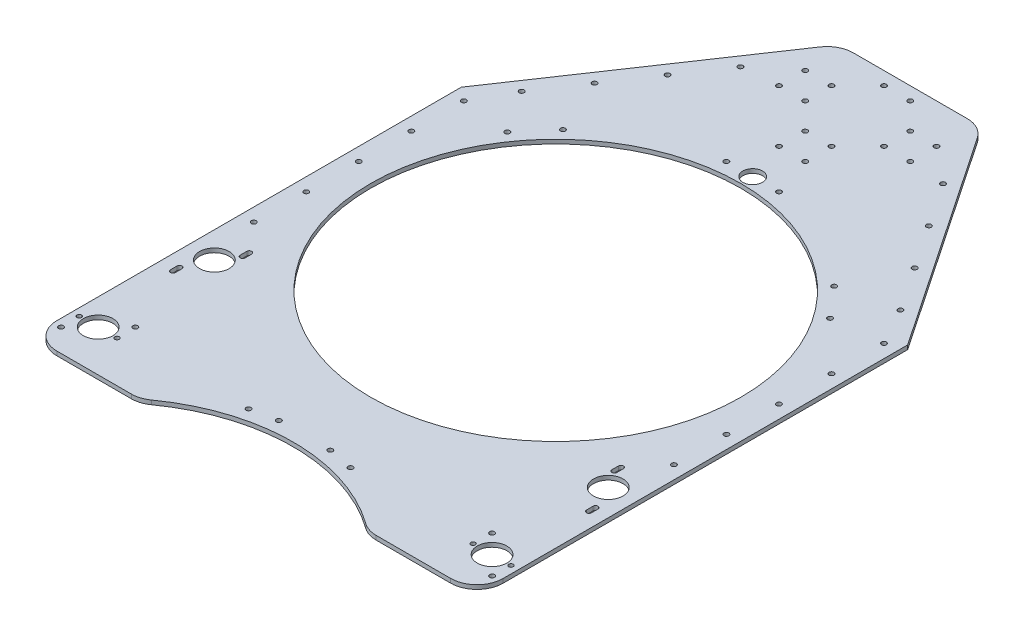
from build123d import *

# Parameters (mm, degrees)
SKETCH1_W           = 431.8
SKETCH1_H           = 685.8
BOSS_EXTRUDE1_DEPTH = 4
SKETCH2_R           = 14.3129
SKETCH2_R_2         = 2.38125
SKETCH2_R_3         = 2.159
CUT_EXTRUDE1_DEPTH  = 406.227368276
SKETCH6_R           = 179.07
CUT_EXTRUDE4_DEPTH  = 406.227368276
SKETCH8_R           = 9.525
SKETCH8_R_2         = 2.38125
CUT_EXTRUDE6_DEPTH  = 406.227368276
FILLET2_R           = 25.4
SKETCH11_R          = 2.38125
CUT_EXTRUDE9_DEPTH  = 406.227368276
SKETCH13_R          = 2.38125
SKETCH13_R_2        = 2.466421692
SKETCH13_R_3        = 2.307769972
CUT_EXTRUDE10_DEPTH = 406.227368276
SKETCH16_W          = 431.8
SKETCH16_H          = 50.8
CUT_EXTRUDE13_DEPTH = 406.227368276
SKETCH17_R          = 177.8
SKETCH17_R_2        = 2.38125
CUT_EXTRUDE14_DEPTH = 406.227368276
FILLET3_R           = 25.4
SKETCH18_R          = 2.38125
CUT_EXTRUDE15_DEPTH = 406.227368276
CHAMFER1_SIZE       = 147.32
CHAMFER1_SIZE2      = 218.410881881
CHAMFER2_SIZE       = 147.32
CHAMFER2_SIZE2      = 218.410881881
FILLET4_R           = 25.4
SKETCH19_R          = 2.38125
CUT_EXTRUDE16_DEPTH = 406.227368276


with BuildPart() as part:
    # Sketch1 → Boss-Extrude1 (new body)
    with BuildSketch(Plane(origin=(0, 0, 0), x_dir=(1, 0, 0), z_dir=(0, 1, 0))):
        Rectangle(SKETCH1_W, SKETCH1_H)
    extrude(amount=BOSS_EXTRUDE1_DEPTH)

    # Sketch2 → Cut-Extrude1 (cut, through all)
    with BuildSketch(Plane(origin=(0, 4, 0), x_dir=(1, 0, 0), z_dir=(0, 1, 0))):
        with Locations(Location((190.5, -302.895, 0), (0, 0, 270))):
            Circle(SKETCH2_R)
        with Locations(Location((208.460512242, -320.855512242, 0), (0, 0, 270))):
            Circle(SKETCH2_R_2)
        with Locations(Location((208.788, -302.895, 0), (0, 0, 270))):
            Circle(SKETCH2_R_3)
        with Locations(Location((172.212, -302.895, 0), (0, 0, 270))):
            Circle(SKETCH2_R_3)
        with Locations(Location((172.539487758, -284.934487758, 0), (0, 0, 270))):
            Circle(SKETCH2_R_2)
        with Locations((201.234503848, -219.870217791)):
            Circle(SKETCH2_R_2)
        with BuildLine():
            ThreePointArc((198.853253848, -219.870217791), (201.234503848, -217.488967791), (203.615753848, -219.870217791))
            Line((203.615753848, -219.870217791), (203.615753848, -213.520217791))
            ThreePointArc((203.615753848, -213.520217791), (201.234503848, -215.901467791), (198.853253848, -213.520217791))
            Line((198.853253848, -213.520217791), (198.853253848, -219.870217791))
        make_face()
        with Locations((201.234503848, -213.520217791)):
            Circle(SKETCH2_R_2)
        with Locations(Location((190.5, -190.5, 0), (0, 0, 270))):
            Circle(SKETCH2_R)
        with Locations((179.765496152, -173.829782209)):
            Circle(SKETCH2_R_2)
        with BuildLine():
            ThreePointArc((177.384246152, -173.829782209), (179.765496152, -171.448532209), (182.146746152, -173.829782209))
            Line((182.146746152, -173.829782209), (182.146746152, -167.479782209))
            ThreePointArc((182.146746152, -167.479782209), (179.765496152, -169.861032209), (177.384246152, -167.479782209))
            Line((177.384246152, -167.479782209), (177.384246152, -173.829782209))
        make_face()
        with Locations((179.765496152, -167.479782209)):
            Circle(SKETCH2_R_2)
        with Locations((-179.765496152, -167.479782209)):
            Circle(SKETCH2_R_2)
        with Locations((-179.765496152, -173.829782209)):
            Circle(SKETCH2_R_2)
        with BuildLine():
            ThreePointArc((-182.146746152, -173.829782209), (-179.765496152, -171.448532209), (-177.384246152, -173.829782209))
            Line((-177.384246152, -173.829782209), (-177.384246152, -167.479782209))
            ThreePointArc((-177.384246152, -167.479782209), (-179.765496152, -169.861032209), (-182.146746152, -167.479782209))
            Line((-182.146746152, -167.479782209), (-182.146746152, -173.829782209))
        make_face()
        with Locations(Location((-190.5, -190.5, 0), (0, 0, 270))):
            Circle(SKETCH2_R)
        with Locations((-201.234503848, -213.520217791)):
            Circle(SKETCH2_R_2)
        with Locations((-201.234503848, -219.870217791)):
            Circle(SKETCH2_R_2)
        with Locations(Location((-190.5, -302.895, 0), (0, 0, 270))):
            Circle(SKETCH2_R)
        with Locations(Location((-208.460512242, -320.855512242, 0), (0, 0, 270))):
            Circle(SKETCH2_R_2)
        with Locations(Location((-208.788, -302.895, 0), (0, 0, 270))):
            Circle(SKETCH2_R_3)
        with Locations(Location((-172.212, -302.895, 0), (0, 0, 270))):
            Circle(SKETCH2_R_3)
        with Locations(Location((-172.539487758, -284.934487758, 0), (0, 0, 270))):
            Circle(SKETCH2_R_2)
        with BuildLine():
            ThreePointArc((-203.615753848, -219.870217791), (-201.234503848, -217.488967791), (-198.853253848, -219.870217791))
            Line((-198.853253848, -219.870217791), (-198.853253848, -213.520217791))
            ThreePointArc((-198.853253848, -213.520217791), (-201.234503848, -215.901467791), (-203.615753848, -213.520217791))
            Line((-203.615753848, -213.520217791), (-203.615753848, -219.870217791))
        make_face()
    extrude(amount=-CUT_EXTRUDE1_DEPTH, mode=Mode.SUBTRACT)

    # Sketch6 → Cut-Extrude4 (cut, through all)
    with BuildSketch(Plane(origin=(0, 4, 0), x_dir=(1, 0, 0), z_dir=(0, 1, 0))):
        with Locations(Location((0, -50.8, 0), (0, 0, 270))):
            Circle(SKETCH6_R)
    extrude(amount=-CUT_EXTRUDE4_DEPTH, mode=Mode.SUBTRACT)

    # Sketch8 → Cut-Extrude6 (cut, through all)
    with BuildSketch(Plane(origin=(0, 4, 0), x_dir=(1, 0, 0), z_dir=(0, 1, 0))):
        with Locations(Location((0, 139.7, 0), (0, 0, 270))):
            Circle(SKETCH8_R)
        with Locations(Location((25.4, 139.7, 0), (0, 0, 270))):
            Circle(SKETCH8_R_2)
        with Locations(Location((-25.4, 139.7, 0), (0, 0, 270))):
            Circle(SKETCH8_R_2)
    extrude(amount=-CUT_EXTRUDE6_DEPTH, mode=Mode.SUBTRACT)

    # Fillet2
    fillet2_edges = [part.edges().sort_by_distance(p)[0] for p in [
        (215.9, 2, 342.9),
        (-215.9, 2, 342.9),
    ]]
    fillet(fillet2_edges, radius=FILLET2_R)

    # Sketch11 → Cut-Extrude9 (cut, through all)
    with BuildSketch(Plane(origin=(0, 4, 0), x_dir=(1, 0, 0), z_dir=(0, 1, 0))):
        with Locations(Location((156.048464437, 58.466311125, 0), (0, 0, 270))):
            Circle(SKETCH11_R)
        with Locations(Location((131.183773775, 87.334237241, 0), (0, 0, 270))):
            Circle(SKETCH11_R)
        with Locations(Location((-131.183773775, 87.334237241, 0), (0, 0, 270))):
            Circle(SKETCH11_R)
        with Locations(Location((-156.048464437, 58.466311125, 0), (0, 0, 270))):
            Circle(SKETCH11_R)
    extrude(amount=-CUT_EXTRUDE9_DEPTH, mode=Mode.SUBTRACT)

    # Sketch13 → Cut-Extrude10 (cut, through all)
    with BuildSketch(Plane(origin=(0, 4, 0), x_dir=(1, 0, 0), z_dir=(0, 1, 0))):
        with Locations(Location((-203.2, 317.5, 0), (0, 0, 270))):
            Circle(SKETCH13_R)
        with Locations(Location((-203.2, 266.7, 0), (0, 0, 270))):
            Circle(SKETCH13_R)
        with Locations(Location((-203.2, 215.9, 0), (0, 0, 270))):
            Circle(SKETCH13_R)
        with Locations(Location((-203.2, 165.1, 0), (0, 0, 270))):
            Circle(SKETCH13_R)
        with Locations(Location((-203.2, 114.3, 0), (0, 0, 270))):
            Circle(SKETCH13_R)
        with Locations(Location((-203.2, 63.5, 0), (0, 0, 270))):
            Circle(SKETCH13_R)
        with Locations(Location((-203.2, 12.7, 0), (0, 0, 270))):
            Circle(SKETCH13_R)
        with Locations(Location((-203.2, -38.1, 0), (0, 0, 270))):
            Circle(SKETCH13_R)
        with Locations(Location((-203.2, -88.9, 0), (0, 0, 270))):
            Circle(SKETCH13_R)
        with Locations(Location((-203.2, -139.7, 0), (0, 0, 270))):
            Circle(SKETCH13_R)
        with Locations(Location((203.2, -139.7, 0), (0, 0, 90))):
            Circle(SKETCH13_R)
        with Locations(Location((203.2, 12.7, 0), (0, 0, 90))):
            Circle(SKETCH13_R)
        with Locations(Location((203.2, 63.5, 0), (0, 0, 90))):
            Circle(SKETCH13_R)
        with Locations(Location((203.2, 114.3, 0), (0, 0, 90))):
            Circle(SKETCH13_R)
        with Locations(Location((203.2, 165.1, 0), (0, 0, 90))):
            Circle(SKETCH13_R)
        with Locations(Location((203.2, 266.7, 0), (0, 0, 90))):
            Circle(SKETCH13_R)
        with Locations(Location((203.2, 317.5, 0), (0, 0, 90))):
            Circle(SKETCH13_R)
        with Locations(Location((-25.4, -330.2, 0), (0, 0, 270))):
            Circle(SKETCH13_R_2)
        with Locations(Location((-50.8, -330.2, 0), (0, 0, 270))):
            Circle(SKETCH13_R_3)
        with Locations(Location((50.8, -330.2, 0), (0, 0, 90))):
            Circle(SKETCH13_R_3)
        with Locations(Location((25.4, -330.2, 0), (0, 0, 90))):
            Circle(SKETCH13_R_2)
        with Locations(Location((203.2, -88.9, 0), (0, 0, 90))):
            Circle(SKETCH13_R)
        with Locations(Location((203.2, -38.1, 0), (0, 0, 90))):
            Circle(SKETCH13_R)
        with Locations(Location((203.2, 215.9, 0), (0, 0, 90))):
            Circle(SKETCH13_R)
    extrude(amount=-CUT_EXTRUDE10_DEPTH, mode=Mode.SUBTRACT)

    # Sketch16 → Cut-Extrude13 (cut, through all)
    with BuildSketch(Plane(origin=(0, 4, 0), x_dir=(1, 0, 0), z_dir=(0, 1, 0))):
        with Locations((0, 317.5)):
            Rectangle(SKETCH16_W, SKETCH16_H)
    extrude(amount=-CUT_EXTRUDE13_DEPTH, mode=Mode.SUBTRACT)

    # Sketch17 → Cut-Extrude14 (cut, through all)
    with BuildSketch(Plane(origin=(0, 0, 0), x_dir=(-1, 0, 0), z_dir=(0, -1, 0))):
        with Locations((0, -482.6)):
            Circle(SKETCH17_R)
        with Locations(Location((24.865239618, -293.729753908, 0), (0, 0, 90))):
            Circle(SKETCH17_R_2)
        with Locations(Location((49.305028092, -298.591130092, 0), (0, 0, 90))):
            Circle(SKETCH17_R_2)
        with Locations(Location((-24.865239618, -293.729753908, 0), (0, 0, 270))):
            Circle(SKETCH17_R_2)
        with Locations(Location((-49.305028092, -298.591130092, 0), (0, 0, 270))):
            Circle(SKETCH17_R_2)
    extrude(amount=-CUT_EXTRUDE14_DEPTH, mode=Mode.SUBTRACT)

    # Fillet3
    fillet3_edges = [part.edges().sort_by_distance(p)[0] for p in [
        (-109.985226281, 2, 342.9),
        (109.985226281, 2, 342.9),
    ]]
    fillet(fillet3_edges, radius=FILLET3_R)

    # Sketch18 → Cut-Extrude15 (cut, through all)
    with BuildSketch(Plane(origin=(0, 4, 0), x_dir=(1, 0, 0), z_dir=(0, 1, 0))):
        with Locations(Location((38.1, 228.6, 0), (0, 0, 270))):
            Circle(SKETCH18_R)
        with Locations(Location((63.5, 228.6, 0), (0, 0, 270))):
            Circle(SKETCH18_R)
        with Locations(Location((63.5, 254, 0), (0, 0, 270))):
            Circle(SKETCH18_R)
        with Locations(Location((38.1, 254, 0), (0, 0, 270))):
            Circle(SKETCH18_R)
        with Locations(Location((-12.7, 177.8, 0), (0, 0, 270))):
            Circle(SKETCH18_R)
        with Locations(Location((-12.7, 203.2, 0), (0, 0, 270))):
            Circle(SKETCH18_R)
        with Locations(Location((12.7, 177.8, 0), (0, 0, 270))):
            Circle(SKETCH18_R)
        with Locations(Location((12.7, 203.2, 0), (0, 0, 270))):
            Circle(SKETCH18_R)
        with Locations(Location((-63.5, 254, 0), (0, 0, 270))):
            Circle(SKETCH18_R)
        with Locations(Location((-38.1, 254, 0), (0, 0, 270))):
            Circle(SKETCH18_R)
        with Locations(Location((-63.5, 228.6, 0), (0, 0, 270))):
            Circle(SKETCH18_R)
        with Locations(Location((-38.1, 228.6, 0), (0, 0, 270))):
            Circle(SKETCH18_R)
        with Locations((12.7, 304.8)):
            Circle(SKETCH18_R)
        with Locations(Location((12.7, 279.4, 0), (0, 0, 270))):
            Circle(SKETCH18_R)
        with Locations((-12.7, 304.8)):
            Circle(SKETCH18_R)
        with Locations(Location((-12.7, 279.4, 0), (0, 0, 270))):
            Circle(SKETCH18_R)
    extrude(amount=-CUT_EXTRUDE15_DEPTH, mode=Mode.SUBTRACT)

    # Chamfer1
    chamfer1_edges = [part.edges().sort_by_distance(p)[0] for p in [
        (215.9, 2, -292.1),
    ]]
    chamfer1_side = [part.faces().sort_by_distance(p)[0] for p in [
        (0, 2, -292.1),
    ]]
    chamfer(chamfer1_edges, length=CHAMFER1_SIZE, length2=CHAMFER1_SIZE2, reference=chamfer1_side[0])

    # Chamfer2
    chamfer2_edges = [part.edges().sort_by_distance(p)[0] for p in [
        (-215.9, 2, -292.1),
    ]]
    chamfer2_side = [part.faces().sort_by_distance(p)[0] for p in [
        (-73.66, 2, -292.1),
    ]]
    chamfer(chamfer2_edges, length=CHAMFER2_SIZE, length2=CHAMFER2_SIZE2, reference=chamfer2_side[0])

    # Fillet4
    fillet4_edges = [part.edges().sort_by_distance(p)[0] for p in [
        (68.58, 2, -292.1),
        (-68.58, 2, -292.1),
    ]]
    fillet(fillet4_edges, radius=FILLET4_R)

    # Sketch19 → Cut-Extrude16 (cut, through all)
    with BuildSketch(Plane(origin=(0, 4, 0), x_dir=(1, 0, 0), z_dir=(0, 1, 0))):
        with Locations(Location((-97.97689967, 225.806, 0), (0, 0, 270))):
            Circle(SKETCH19_R)
        with Locations(Location((-126.383899166, 183.690891314, 0), (0, 0, 270))):
            Circle(SKETCH19_R)
        with Locations(Location((-154.790898662, 141.575782628, 0), (0, 0, 270))):
            Circle(SKETCH19_R)
        with Locations(Location((-183.197898158, 99.460673943, 0), (0, 0, 270))):
            Circle(SKETCH19_R)
        with Locations(Location((183.197898158, 99.460673943, 0), (0, 0, 90))):
            Circle(SKETCH19_R)
        with Locations(Location((154.790898662, 141.575782628, 0), (0, 0, 90))):
            Circle(SKETCH19_R)
        with Locations(Location((126.383899166, 183.690891314, 0), (0, 0, 90))):
            Circle(SKETCH19_R)
        with Locations(Location((97.97689967, 225.806, 0), (0, 0, 90))):
            Circle(SKETCH19_R)
    extrude(amount=-CUT_EXTRUDE16_DEPTH, mode=Mode.SUBTRACT)


solid = part.part
